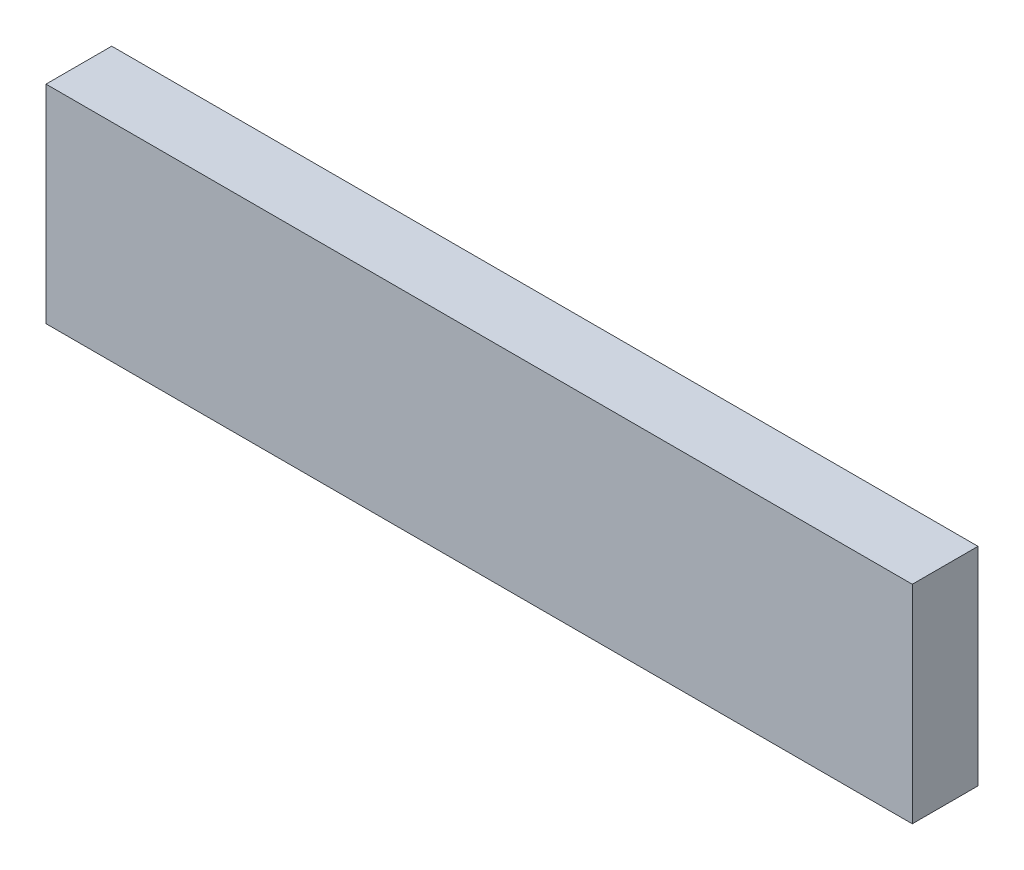
from build123d import *

# Parameters (mm, degrees)
SKETCH1_W           = 0.38
SKETCH1_H           = 1.2
BOSS_EXTRUDE1_DEPTH = 2.505


with BuildPart() as part:
    # Sketch1 → Boss-Extrude1 (new, symmetric)
    with BuildSketch(Plane(origin=(0, 0, 1.362821821), x_dir=(0, 0, 1), z_dir=(-1, 0, 0))):
        with Locations((-1.362821821, 0)):
            Rectangle(SKETCH1_W, SKETCH1_H)
    extrude(amount=BOSS_EXTRUDE1_DEPTH, both=True)


solid = part.part
